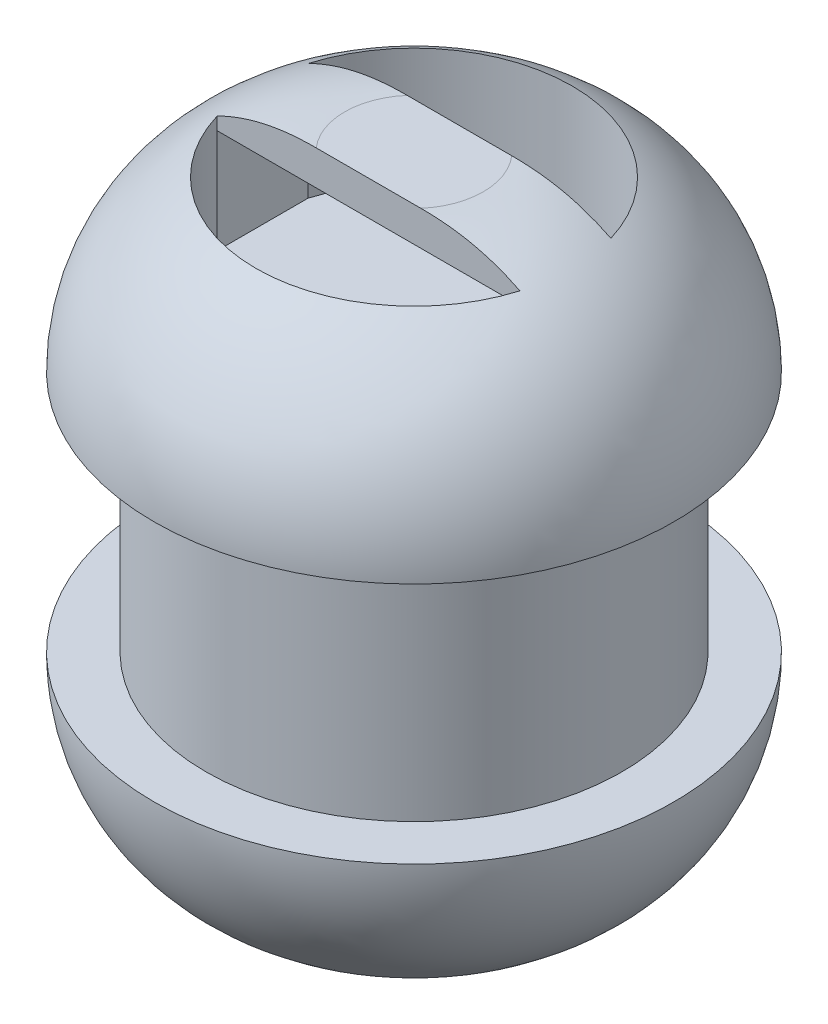
from build123d import *

# Parameters (mm, degrees)
SKETCH1_R           = 30
BOSS_EXTRUDE1_DEPTH = 36
FILLET1_R           = 22
FILLET2_R           = 22
SKETCH3_OUTSIDE_W   = 84.256
SKETCH3_OUTSIDE_H   = 84.256
SKETCH3_OUTSIDE_R   = 24
CUT_EXTRUDE2_DEPTH  = 14
CUT_EXTRUDE3_DEPTH  = 16
SKETCH6_W           = 34.957116586
SKETCH6_H           = 10.5
CUT_EXTRUDE9_DEPTH  = 12


with BuildPart() as part:
    # Sketch1 → Boss-Extrude1 (new, symmetric)
    with BuildSketch(Plane(origin=(0, 0, 0), x_dir=(1, 0, 0), z_dir=(0, 1, 0))):
        with Locations(Location((0, 0, 0), (0, 0, 270))):
            Circle(SKETCH1_R)
    extrude(amount=BOSS_EXTRUDE1_DEPTH, both=True)

    # Fillet1
    fillet1_edges = [part.edges().sort_by_distance(p)[0] for p in [
        (0, 36, -30),
    ]]
    fillet(fillet1_edges, radius=FILLET1_R)

    # Fillet2
    fillet2_edges = [part.edges().sort_by_distance(p)[0] for p in [
        (0, -36, -30),
    ]]
    fillet(fillet2_edges, radius=FILLET2_R)

    # Sketch3 outside → Cut-Extrude2 (cut, symmetric)
    with BuildSketch(Plane(origin=(0, 0, 0), x_dir=(1, 0, 0), z_dir=(0, 1, 0))):
        Rectangle(SKETCH3_OUTSIDE_W, SKETCH3_OUTSIDE_H)
        with Locations(Location((0, 0, 0), (0, 0, 270))):
            Circle(SKETCH3_OUTSIDE_R, mode=Mode.SUBTRACT)
    extrude(amount=CUT_EXTRUDE2_DEPTH, both=True, mode=Mode.SUBTRACT)

    # Sketch4 → Cut-Extrude3 (cut)
    with BuildSketch(Plane(origin=(0, 36, 0), x_dir=(1, 0, 0), z_dir=(0, 1, 0))):
        with BuildLine():
            ThreePointArc((6.036348234, 5.25), (0, 8), (-6.036348234, 5.25))
            Line((-6.036348234, 5.25), (6.036348234, 5.25))
        make_face()
        with BuildLine():
            ThreePointArc((17.478558293, 5.25), (0, 18.25), (-17.478558293, 5.25))
            Line((-17.478558293, 5.25), (-6.036348234, 5.25))
            ThreePointArc((-6.036348234, 5.25), (0, 8), (6.036348234, 5.25))
            Line((6.036348234, 5.25), (17.478558293, 5.25))
        make_face()
        with BuildLine():
            Line((6.036348234, -5.25), (-6.036348234, -5.25))
            ThreePointArc((-6.036348234, -5.25), (0, -8), (6.036348234, -5.25))
        make_face()
        with BuildLine():
            Line((-6.036348234, -5.25), (-17.478558293, -5.25))
            ThreePointArc((-17.478558293, -5.25), (0, -18.25), (17.478558293, -5.25))
            Line((17.478558293, -5.25), (6.036348234, -5.25))
            ThreePointArc((6.036348234, -5.25), (0, -8), (-6.036348234, -5.25))
        make_face()
    extrude(amount=-CUT_EXTRUDE3_DEPTH, mode=Mode.SUBTRACT)

    # Sketch6 → Cut-Extrude9 (cut)
    with BuildSketch(Plane(origin=(0, 20, 0), x_dir=(1, 0, 0), z_dir=(0, 1, 0))):
        Rectangle(SKETCH6_W, SKETCH6_H)
    extrude(amount=CUT_EXTRUDE9_DEPTH, mode=Mode.SUBTRACT)


solid = part.part
